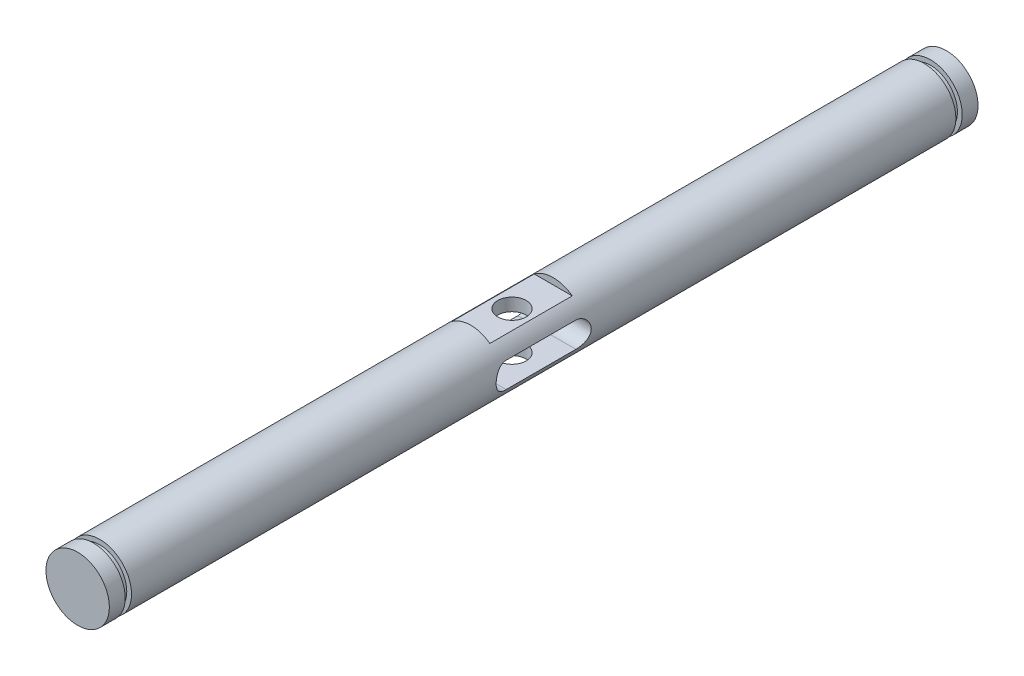
from build123d import *

# Parameters (mm, degrees)
BOSS_EXTRUDE1_DEPTH      = 130
BOSS_EXTRUDE1_DEPTH_BACK = 130
SKETCH3_R                = 10
SKETCH4_R                = 8.5
BOSS_EXTRUDE2_DEPTH      = 2
SKETCH5_R                = 10
BOSS_EXTRUDE3_DEPTH      = 5
BOSS_EXTRUDE4_START      = 2
SKETCH6_R                = 8.5
BOSS_EXTRUDE4_DEPTH      = 2
BOSS_EXTRUDE5_START      = 5
SKETCH7_R                = 10
BOSS_EXTRUDE5_DEPTH      = 5
CUT_EXTRUDE1_DEPTH       = 138.727992797
CUT_EXTRUDE1_DEPTH_BACK  = 138.727992797
SKETCH8_W                = 26
SKETCH8_H                = 2
SKETCH9_R                = 4.5
CUT_EXTRUDE2_DEPTH       = 139.538803249


with BuildPart() as part:
    # Sketch3 → Boss-Extrude1 (new, two sides: drawn at the far end of the back side and taken through both)
    with BuildSketch(Plane.XY.offset(-BOSS_EXTRUDE1_DEPTH_BACK)):
        Circle(SKETCH3_R)
    extrude(amount=BOSS_EXTRUDE1_DEPTH + BOSS_EXTRUDE1_DEPTH_BACK)

    # Sketch4 → Boss-Extrude2 (add)
    with BuildSketch(Plane.XY.offset(130)):
        Circle(SKETCH4_R)
    extrude(amount=BOSS_EXTRUDE2_DEPTH)

    # Sketch5 → Boss-Extrude3 (add)
    with BuildSketch(Plane.XY.offset(132)):
        Circle(SKETCH5_R)
    extrude(amount=BOSS_EXTRUDE3_DEPTH)

    # Sketch6 → Boss-Extrude4 (add)
    with BuildSketch(Plane(origin=(0, 0, -130), x_dir=(-1, 0, 0), z_dir=(0, 0, -1)).offset(BOSS_EXTRUDE4_START)):
        Circle(SKETCH6_R)
    extrude(amount=-BOSS_EXTRUDE4_DEPTH)

    # Sketch7 → Boss-Extrude5 (add)
    with BuildSketch(Plane(origin=(0, 0, -132), x_dir=(-1, 0, 0), z_dir=(0, 0, -1)).offset(BOSS_EXTRUDE5_START)):
        Circle(SKETCH7_R)
    extrude(amount=-BOSS_EXTRUDE5_DEPTH)

    # Sketch8 → Cut-Extrude1 (cut, two sides: drawn at the far end of the back side and taken through both)
    with BuildSketch(Plane(origin=(0, 0, 0), x_dir=(0, 0, -1), z_dir=(1, 0, 0)).offset(-CUT_EXTRUDE1_DEPTH_BACK)):
        with Locations((0, 9)):
            Rectangle(SKETCH8_W, SKETCH8_H)
        with Locations((0, -9)):
            Rectangle(SKETCH8_W, SKETCH8_H)
        with BuildLine():
            Line((11, 4), (-11, 4))
            ThreePointArc((-11, 4), (-15, 0), (-11, -4))
            Line((-11, -4), (11, -4))
            ThreePointArc((11, -4), (15, 0), (11, 4))
        make_face()
    extrude(amount=CUT_EXTRUDE1_DEPTH + CUT_EXTRUDE1_DEPTH_BACK, mode=Mode.SUBTRACT)

    # Sketch9 → Cut-Extrude2 (cut, through all)
    with BuildSketch(Plane(origin=(0, 8, 0), x_dir=(1, 0, 0), z_dir=(0, 1, 0))):
        Circle(SKETCH9_R)
    extrude(amount=-CUT_EXTRUDE2_DEPTH, mode=Mode.SUBTRACT)


solid = part.part
